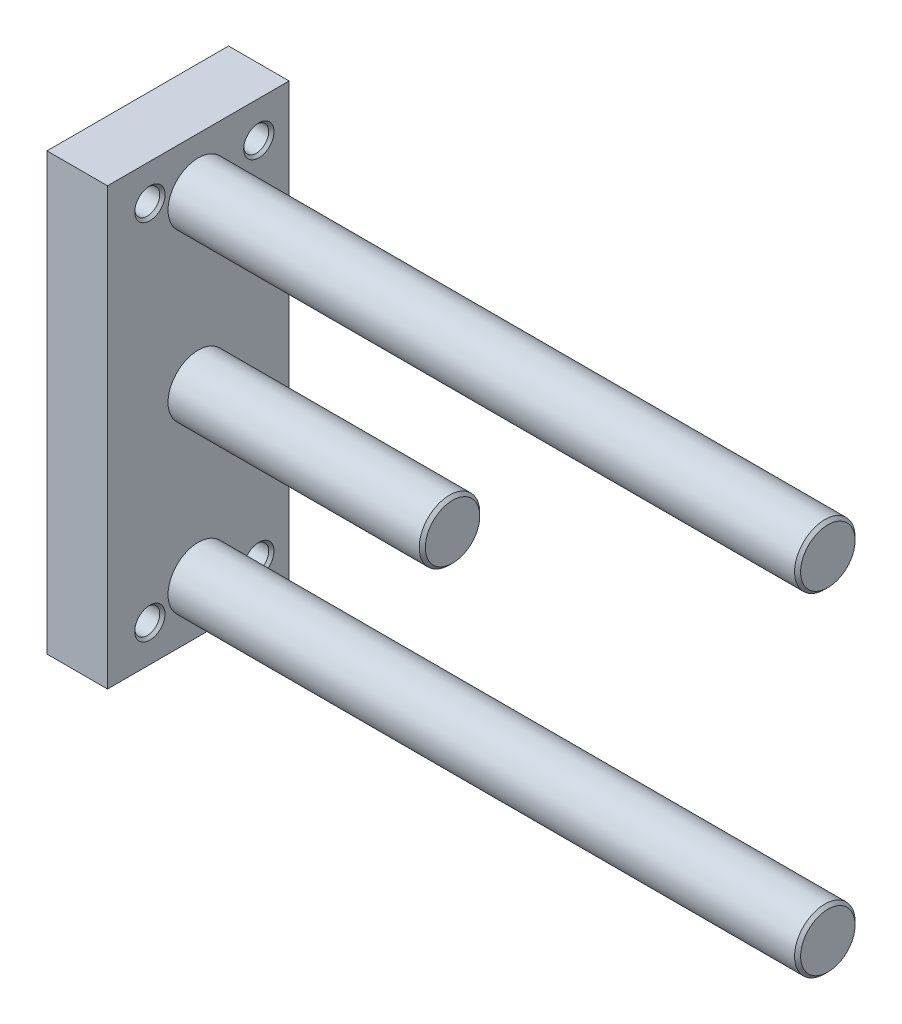
from build123d import *

# Parameters (mm, degrees)
SKETCH1_W           = 30
SKETCH1_H           = 72
BOSS_EXTRUDE1_DEPTH = 10


with BuildPart() as part:
    # Sketch1 → Boss-Extrude1 (new body)
    with BuildSketch(Plane(origin=(0, 0, 0), x_dir=(0, 0, -1), z_dir=(1, 0, 0))):
        Rectangle(SKETCH1_W, SKETCH1_H)
    extrude(amount=BOSS_EXTRUDE1_DEPTH)

    # Sketch2 → Cut-Revolve1 (revolve, cut)
    with BuildSketch(Plane(origin=(0, 30, 0), x_dir=(-1, 0, 0), z_dir=(0, 1, 0)), mode=Mode.PRIVATE) as cut_revolve1_sk:
        Polygon((0, -10), (0, -12.5), (-0.433, -12.067), (-9.567, -12.067), (-10, -12.5), (-10, -10), align=None)
    revolve(cut_revolve1_sk.sketch.rotate(Axis((10, 30, -10), (-1, 0, 0)), 180), axis=Axis((10, 30, -10), (-1, 0, 0)), mode=Mode.SUBTRACT)

    # Sketch3 → Cut-Revolve2 (revolve, cut)
    with BuildSketch(Plane(origin=(0, 30, 0), x_dir=(-1, 0, 0), z_dir=(0, 1, 0)), mode=Mode.PRIVATE) as cut_revolve2_sk:
        Polygon((0, 8), (0, 5.5), (-0.433, 5.933), (-9.567, 5.933), (-10, 5.5), (-10, 8), align=None)
    revolve(cut_revolve2_sk.sketch.rotate(Axis((10, 30, 8), (-1, 0, 0)), 180), axis=Axis((10, 30, 8), (-1, 0, 0)), mode=Mode.SUBTRACT)

    # Sketch4 → Cut-Revolve3 (revolve, cut)
    with BuildSketch(Plane(origin=(0, -30, 0), x_dir=(-1, 0, 0), z_dir=(0, 1, 0)), mode=Mode.PRIVATE) as cut_revolve3_sk:
        Polygon((0, 8), (0, 5.5), (-0.433, 5.933), (-9.567, 5.933), (-10, 5.5), (-10, 8), align=None)
    revolve(cut_revolve3_sk.sketch.rotate(Axis((10, -30, 8), (-1, 0, 0)), 180), axis=Axis((10, -30, 8), (-1, 0, 0)), mode=Mode.SUBTRACT)

    # Sketch5 → Cut-Revolve4 (revolve, cut)
    with BuildSketch(Plane(origin=(0, -30, 0), x_dir=(-1, 0, 0), z_dir=(0, 1, 0)), mode=Mode.PRIVATE) as cut_revolve4_sk:
        Polygon((0, -10), (0, -12.5), (-0.433, -12.067), (-9.567, -12.067), (-10, -12.5), (-10, -10), align=None)
    revolve(cut_revolve4_sk.sketch.rotate(Axis((10, -30, -10), (-1, 0, 0)), 180), axis=Axis((10, -30, -10), (-1, 0, 0)), mode=Mode.SUBTRACT)

    # Sketch6 → Cut-Revolve5 (revolve, cut)
    with BuildSketch(Plane(origin=(0, 27.5, 0), x_dir=(-1, 0, 0), z_dir=(0, 1, 0)), mode=Mode.PRIVATE) as cut_revolve5_sk:
        Polygon((0, 0), (0, -3.8), (-5.555555556, -3.8), (-5.555555556, -3.5), (-2.055555556, -3.5), (-1.555555556, -3), (-1.555555556, -1.5), (-4.155555556, -1.5), (-5.021580959, 0), align=None)
    revolve(cut_revolve5_sk.sketch.rotate(Axis((5.021580959, 27.5, 0), (-1, 0, 0)), 180), axis=Axis((5.021580959, 27.5, 0), (-1, 0, 0)), mode=Mode.SUBTRACT)

    # Sketch7 → Cut-Revolve6 (revolve, cut)
    with BuildSketch(Plane(origin=(0, 0, 0), x_dir=(-1, 0, 0), z_dir=(0, 1, 0)), mode=Mode.PRIVATE) as cut_revolve6_sk:
        Polygon((0, 0), (0, -3.8), (-5.555555556, -3.8), (-5.555555556, -3.5), (-2.055555556, -3.5), (-1.555555556, -3), (-1.555555556, -1.5), (-4.155555556, -1.5), (-5.021580959, 0), align=None)
    revolve(cut_revolve6_sk.sketch.rotate(Axis((5.021580959, 0, 0), (-1, 0, 0)), 180), axis=Axis((5.021580959, 0, 0), (-1, 0, 0)), mode=Mode.SUBTRACT)

    # Sketch8 → Cut-Revolve7 (revolve, cut)
    with BuildSketch(Plane(origin=(0, -27.5, 0), x_dir=(-1, 0, 0), z_dir=(0, 1, 0)), mode=Mode.PRIVATE) as cut_revolve7_sk:
        Polygon((0, 0), (0, -3.8), (-5.555555556, -3.8), (-5.555555556, -3.5), (-2.055555556, -3.5), (-1.555555556, -3), (-1.555555556, -1.5), (-4.155555556, -1.5), (-5.021580959, 0), align=None)
    revolve(cut_revolve7_sk.sketch.rotate(Axis((5.021580959, -27.5, 0), (-1, 0, 0)), 180), axis=Axis((5.021580959, -27.5, 0), (-1, 0, 0)), mode=Mode.SUBTRACT)

    # Sketch9 → Revolve1 (revolve)
    with BuildSketch(Plane(origin=(0, 0, 0), x_dir=(-1, 0, 0), z_dir=(0, 1, 0)), mode=Mode.PRIVATE) as revolve1_sk:
        Polygon((-10, 0), (-10, -5), (-51.5, -5), (-52, -4.5), (-52, 0), align=None)
    revolve(revolve1_sk.sketch.rotate(Axis((52, 0, 0), (-1, 0, 0)), 180), axis=Axis((52, 0, 0), (-1, 0, 0)))

    # Sketch10 → Revolve2 (revolve)
    with BuildSketch(Plane(origin=(0, -27.5, 0), x_dir=(-1, 0, 0), z_dir=(0, 1, 0)), mode=Mode.PRIVATE) as revolve2_sk:
        Polygon((-10, 0), (-10, -5), (-113.5, -5), (-114, -4.5), (-114, 0), align=None)
    revolve(revolve2_sk.sketch.rotate(Axis((114, -27.5, 0), (-1, 0, 0)), 180), axis=Axis((114, -27.5, 0), (-1, 0, 0)))

    # Sketch11 → Revolve3 (revolve)
    with BuildSketch(Plane(origin=(0, 27.5, 0), x_dir=(-1, 0, 0), z_dir=(0, 1, 0)), mode=Mode.PRIVATE) as revolve3_sk:
        Polygon((-10, 0), (-10, -5), (-113.5, -5), (-114, -4.5), (-114, 0), align=None)
    revolve(revolve3_sk.sketch.rotate(Axis((114, 27.5, 0), (-1, 0, 0)), 180), axis=Axis((114, 27.5, 0), (-1, 0, 0)))


solid = part.part
